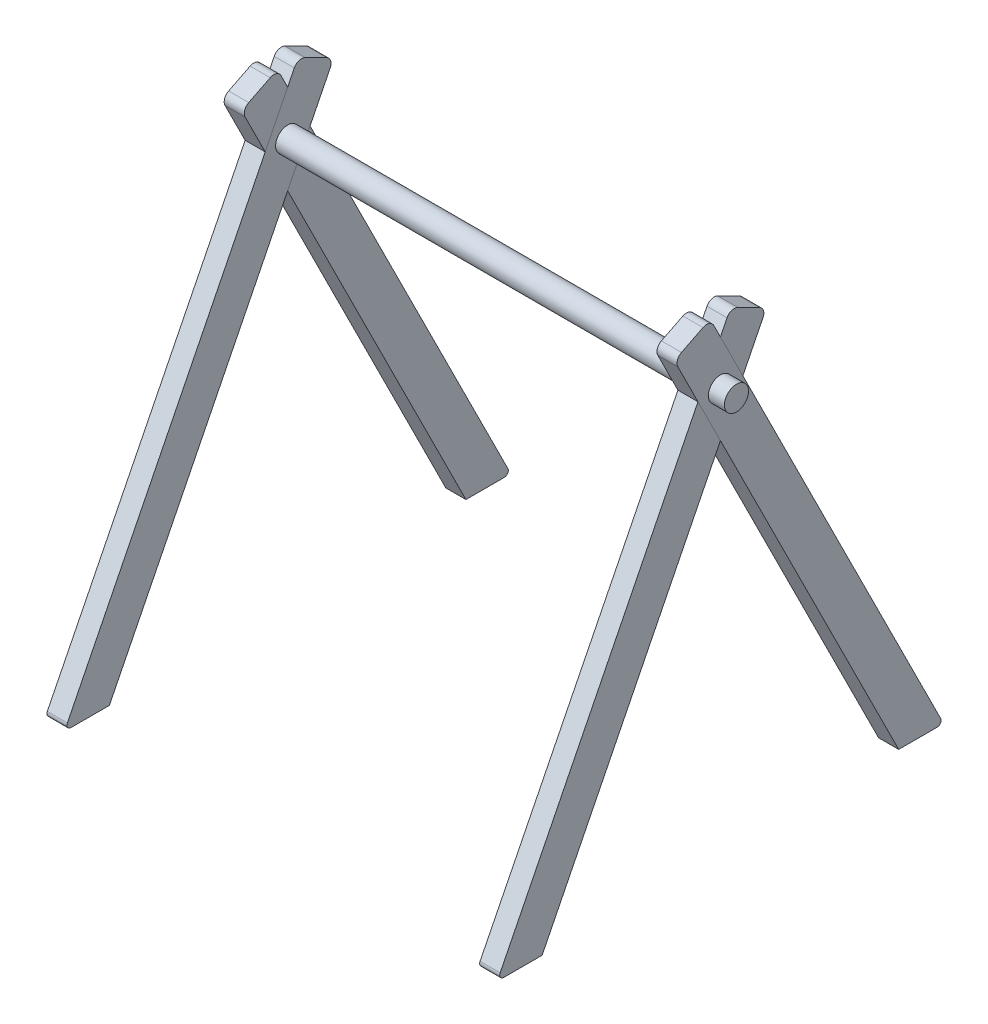
from build123d import *

# Parameters (mm, degrees)
BOSS_EXTRUDE1_DEPTH      = 25
BOSS_EXTRUDE2_DEPTH      = 25
CUT_EXTRUDE1_DEPTH       = 12.5
CUT_EXTRUDE2_DEPTH       = 12.5
SKETCH8_R                = 15
CUT_EXTRUDE3_DEPTH       = 645.888885669
SKETCH9_R                = 3.25
CUT_EXTRUDE4_DEPTH       = 645.888885669
FILLET1_R                = 10
FILLET2_R                = 10
FILLET3_R                = 5
FILLET4_R                = 5
SKETCH10_R               = 15
BOSS_EXTRUDE4_DEPTH      = 539
BOSS_EXTRUDE5_DEPTH      = 22
BOSS_EXTRUDE5_DEPTH_BACK = 20
SKETCH17_R               = 3
SKETCH18_R               = 15
BOSS_EXTRUDE6_DEPTH      = 20
SKETCH19_R               = 3
CUT_EXTRUDE5_DEPTH       = 10


with BuildPart() as part:
    # Sketch4 → Boss-Extrude1 (new body)
    with BuildSketch(Plane(origin=(0, 0, 0), x_dir=(0, 0, -1), z_dir=(1, 0, 0))):
        Polygon((-277.950849719, 0), (-222.049150281, 0), (57.459346906, 559.016994375), (12.737987356, 581.37767415), align=None)
    extrude(amount=BOSS_EXTRUDE1_DEPTH)

    # Sketch6 → Cut-Extrude1 (cut)
    with BuildSketch(Plane.ZY):
        Polygon((12.737987356, 581.37767415), (-277.950849719, 0), (-222.049150281, 0), (57.459346906, 559.016994375), align=None)
    extrude(amount=-CUT_EXTRUDE1_DEPTH, mode=Mode.SUBTRACT)

    # Sketch8 → Cut-Extrude3 (cut, through all)
    with BuildSketch(Plane(origin=(25, 0, 0), x_dir=(0, 0, -1), z_dir=(1, 0, 0))):
        with Locations((0, 500)):
            Circle(SKETCH8_R)
    extrude(amount=-CUT_EXTRUDE3_DEPTH, mode=Mode.SUBTRACT)

    # Fillet2
    fillet2_edges = [part.edges().sort_by_distance(p)[0] for p in [
        (12.5, 581.37767415, -12.737987356),
        (12.5, 559.016994375, -57.459346906),
    ]]
    fillet(fillet2_edges, radius=FILLET2_R)

    # Fillet3
    fillet3_edges = [part.edges().sort_by_distance(p)[0] for p in [
        (12.5, 0, 277.950849719),
    ]]
    fillet(fillet3_edges, radius=FILLET3_R)


with BuildPart() as body_2:
    # Sketch5 → Boss-Extrude2 (new body)
    with BuildSketch(Plane(origin=(0, 0, 0), x_dir=(0, 0, -1), z_dir=(1, 0, 0))):
        Polygon((222.049150281, 0), (277.950849719, 0), (-12.737987356, 581.37767415), (-57.459346906, 559.016994375), align=None)
    extrude(amount=BOSS_EXTRUDE2_DEPTH)

    # Sketch7 → Cut-Extrude2 (cut)
    with BuildSketch(Plane(origin=(25, 0, 0), x_dir=(0, 0, -1), z_dir=(1, 0, 0))):
        Polygon((12.737987356, 581.37767415), (-277.950849719, 0), (-222.049150281, 0), (57.459346906, 559.016994375), align=None)
    extrude(amount=-CUT_EXTRUDE2_DEPTH, mode=Mode.SUBTRACT)

    # Sketch9 → Cut-Extrude4 (cut, through all)
    with BuildSketch(Plane(origin=(25, 0, 0), x_dir=(0, 0, -1), z_dir=(1, 0, 0))):
        with Locations((0, 500)):
            Circle(SKETCH9_R)
    extrude(amount=-CUT_EXTRUDE4_DEPTH, mode=Mode.SUBTRACT)

    # Fillet1
    fillet1_edges = [body_2.edges().sort_by_distance(p)[0] for p in [
        (12.5, 559.016994375, 57.459346906),
        (12.5, 581.37767415, 12.737987356),
    ]]
    fillet(fillet1_edges, radius=FILLET1_R)

    # Fillet4
    fillet4_edges = [body_2.edges().sort_by_distance(p)[0] for p in [
        (12.5, 0, -277.950849719),
    ]]
    fillet(fillet4_edges, radius=FILLET4_R)


with BuildPart() as body_3:
    # Mirror1: mirrored copy
    add(part.part.mirror(Plane(origin=(282, 0, 0), x_dir=(0, 0, 1), z_dir=(1, 0, 0))))


with BuildPart() as body_4:
    # Mirror1 2: mirrored copy
    add(body_2.part.mirror(Plane(origin=(282, 0, 0), x_dir=(0, 0, 1), z_dir=(1, 0, 0))))


with BuildPart() as body_5:
    # Sketch10 → Boss-Extrude4 (new body)
    with BuildSketch(Plane(origin=(12.5, 0, 0), x_dir=(0, 0, -1), z_dir=(1, 0, 0))):
        with Locations(Location((0, 500, 0), (0, 0, 180))):
            Circle(SKETCH10_R)
    extrude(amount=BOSS_EXTRUDE4_DEPTH)

    # Sketch14 → M6 Tapped Hole1 (revolve, cut)
    with BuildSketch(Plane(origin=(12.5, 500, 0), x_dir=(0, 0, 1), z_dir=(0, 1, 0))):
        Polygon((0, 0), (0, 26.502151548), (2.5, 25), (2.5, 0), align=None)
    revolve(axis=Axis((6.15, 500, 0), (1, 0, 0)), mode=Mode.SUBTRACT)

    # Sketch16 → M6 Tapped Hole2 (revolve, cut)
    with BuildSketch(Plane(origin=(551.5, 500, 0), x_dir=(0, 0, -1), z_dir=(0, 1, 0))):
        Polygon((0, 0), (0, 26.502151548), (2.5, 25), (2.5, 0), align=None)
    revolve(axis=Axis((557.85, 500, 0), (-1, 0, 0)), mode=Mode.SUBTRACT)


with BuildPart() as body_6:
    # Sketch17 → Boss-Extrude5 (new, two sides: drawn at the far end of the back side and taken through both)
    with BuildSketch(Plane.ZY.offset(-12.5).offset(-BOSS_EXTRUDE5_DEPTH_BACK)):
        with Locations((0, 500)):
            Circle(SKETCH17_R)
    extrude(amount=BOSS_EXTRUDE5_DEPTH + BOSS_EXTRUDE5_DEPTH_BACK)


with BuildPart() as body_7:
    # Mirror3: mirrored copy
    add(body_6.part.mirror(Plane(origin=(282, 0, 0), x_dir=(0, 0, 1), z_dir=(1, 0, 0))))


with BuildPart() as body_8:
    # Sketch18 → Boss-Extrude6 (new body)
    with BuildSketch(Plane.ZY):
        with Locations((0, 500)):
            Circle(SKETCH18_R)
    extrude(amount=BOSS_EXTRUDE6_DEPTH)

    # Sketch19 → Cut-Extrude5 (cut)
    with BuildSketch(Plane.ZY):
        with Locations((0, 500)):
            Circle(SKETCH19_R)
    extrude(amount=CUT_EXTRUDE5_DEPTH, mode=Mode.SUBTRACT)


with BuildPart() as body_9:
    # Mirror4: mirrored copy
    add(body_8.part.mirror(Plane(origin=(282, 0, 0), x_dir=(0, 0, 1), z_dir=(1, 0, 0))))


solid = Compound([part.part, body_2.part, body_3.part, body_4.part, body_5.part, body_6.part, body_7.part, body_8.part, body_9.part])
